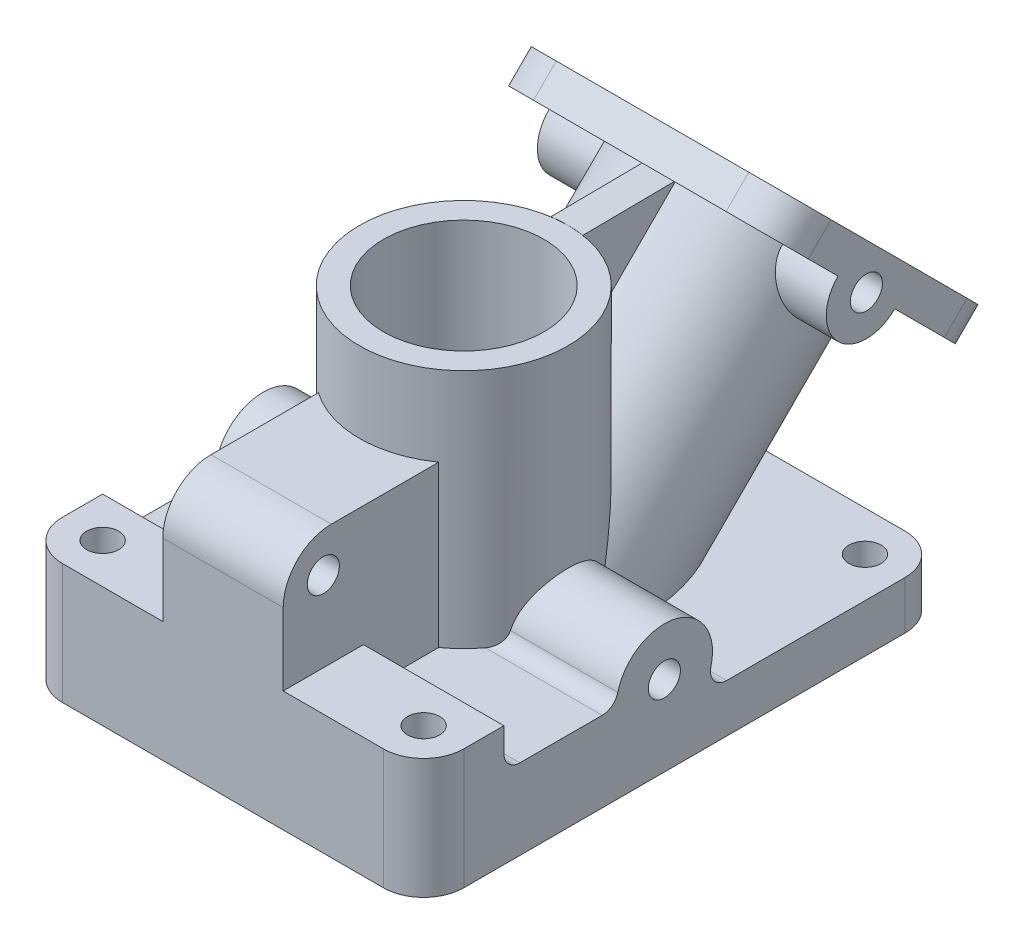
from build123d import *

# Parameters (mm, degrees)
CROQUIS1_W                   = 50
CROQUIS1_H                   = 65
SALIENTE_EXTRUIR1_DEPTH      = 6
CROQUIS3_R                   = 13
CROQUIS3_R_2                 = 10
SALIENTE_EXTRUIR2_DEPTH      = 34
SALIENTE_EXTRUIR3_REACH      = 79.942
CROQUIS9_R                   = 13
CROQUIS9_R_2                 = 10
CROQUIS3_3_R                 = 10
CORTAR_EXTRUIR1_DEPTH        = 34
CROQUIS10_W                  = 36
CROQUIS10_H                  = 36
CROQUIS10_R                  = 10
SALIENTE_EXTRUIR4_DEPTH      = 4
CORTAR_EXTRUIR7_START        = -4
CROQUIS12_R                  = 2
CORTAR_EXTRUIR7_DEPTH        = 4
MATRIZL1_COUNT               = 2
MATRIZL1_PITCH               = 26
MATRIZL1_COUNT_DIR2          = 2
MATRIZL1_PITCH_DIR2          = 26
SALIENTE_EXTRUIR6_REACH      = 80.545
SALIENTE_EXTRUIR6_END_RADIUS = 13
CORTAR_EXTRUIR8_REACH        = 80.545
SALIENTE_EXTRUIR7_REACH      = 80.545
SALIENTE_EXTRUIR7_END_RADIUS = 13
CORTAR_EXTRUIR9_REACH        = 80.545
SALIENTE_EXTRUIR8_REACH      = 84.586
SALIENTE_EXTRUIR8_END_RADIUS = 13
CROQUIS16_R                  = 2
SALIENTE_EXTRUIR9_START      = 24
CROQUIS17_W                  = 7.5
CROQUIS17_H                  = 17
SALIENTE_EXTRUIR9_DEPTH      = 24
CROQUIS18_R                  = 2
CORTAR_EXTRUIR10_DEPTH       = 15
SALIENTE_EXTRUIR10_DEPTH     = 17.5
SALIENTE_EXTRUIR11_REACH     = 84.586
CROQUIS19_R                  = 2
SALIENTE_EXTRUIR12_START     = 17.5
SALIENTE_EXTRUIR12_DEPTH     = 17.5
REDONDEO1_R                  = 5
REDONDEO2_R                  = 6
CROQUIS21_R                  = 2
CORTAR_EXTRUIR11_DEPTH       = 15
MATRIZL2_COUNT               = 2
MATRIZL2_PITCH               = 40
MATRIZL2_COUNT_DIR2          = 2
MATRIZL2_PITCH_DIR2          = 55
NERVIO2_REACH                = 72.323
CROQUIS22_WALL_W             = 153.876760578
CROQUIS22_WALL_H             = 4
NERVIO13_REACH               = 72.323
CROQUIS23_WALL_W             = 150.81965946
CROQUIS23_WALL_H             = 4


with BuildPart() as part:
    # Croquis1 → Saliente-Extruir1 (new body)
    with BuildSketch(Plane(origin=(0, 0, 0), x_dir=(1, 0, 0), z_dir=(0, 1, 0))):
        Rectangle(CROQUIS1_W, CROQUIS1_H)
    extrude(amount=SALIENTE_EXTRUIR1_DEPTH)

    # Croquis3 → Saliente-Extruir2 (add)
    with BuildSketch(Plane(origin=(0, 40, 0), x_dir=(1, 0, 0), z_dir=(0, 1, 0))):
        with Locations(Location((0, -2.5, 0), (0, 0, 270))):
            Circle(CROQUIS3_R)
        with Locations(Location((0, -2.5, 0), (0, 0, 270))):
            Circle(CROQUIS3_R_2, mode=Mode.SUBTRACT)
    extrude(amount=-SALIENTE_EXTRUIR2_DEPTH)

    # Saliente-Extruir3: up to this plane
    saliente_extruir3_end = Plane(origin=(0, 6, 0), z_dir=(0, 1, 0))
    # Croquis9 → Saliente-Extruir3 (add, up to the surface)
    with BuildSketch(Plane(origin=(0, 35, -32.5), x_dir=(-1, 0, 0), z_dir=(0, 0.7071067811865465, -0.7071067811865486)), mode=Mode.PRIVATE) as saliente_extruir3_sk1:
        with Locations(Location((0, -1.767766953, 0), (0, 0, 90))):
            Circle(CROQUIS9_R)
        with Locations(Location((0, -1.767766953, 0), (0, 0, 90))):
            Circle(CROQUIS9_R_2, mode=Mode.SUBTRACT)
    saliente_extruir3_tool1 = split(extrude(saliente_extruir3_sk1.sketch, amount=-SALIENTE_EXTRUIR3_REACH, mode=Mode.PRIVATE), bisect_by=saliente_extruir3_end, keep=Keep.BOTH, mode=Mode.PRIVATE)
    add(saliente_extruir3_tool1.solids().sort_by_distance((0, 24.817612, -42.682388))[0])

    # Croquis3<3> → Cortar-Extruir1 (cut)
    with BuildSketch(Plane(origin=(0, 40, 0), x_dir=(1, 0, 0), z_dir=(0, 1, 0))):
        with Locations(Location((0, -2.5, 0), (0, 0, 270))):
            Circle(CROQUIS3_3_R)
    extrude(amount=-CORTAR_EXTRUIR1_DEPTH, mode=Mode.SUBTRACT)

    # Croquis10 → Saliente-Extruir4 (add)
    with BuildSketch(Plane(origin=(0, 35, -32.5), x_dir=(-1, 0, 0), z_dir=(0, 0.7071067811865465, -0.7071067811865486))):
        with Locations((0, -1.767766953)):
            Rectangle(CROQUIS10_W, CROQUIS10_H)
        with Locations(Location((0, -1.767766953, 0), (0, 0, 90))):
            Circle(CROQUIS10_R, mode=Mode.SUBTRACT)
    extrude(amount=-SALIENTE_EXTRUIR4_DEPTH)

    # Croquis12 → Cortar-Extruir7 (cut)
    with BuildSketch(Plane(origin=(0, 35, -32.5), x_dir=(-1, 0, 0), z_dir=(0, 0.7071067811865465, -0.7071067811865486)).offset(CORTAR_EXTRUIR7_START)):
        with Locations(Location((13, -14.767766953, 0), (0, 0, 90))):
            Circle(CROQUIS12_R)
    cortar_extruir7 = extrude(amount=CORTAR_EXTRUIR7_DEPTH, mode=Mode.SUBTRACT)

    # MatrizL1: Cortar-Extruir7 2 × 2
    with Locations(*[Vector(0, 0.7071067811865486, 0.7071067811865465) * (i * MATRIZL1_PITCH) + Vector(1, 0, 0) * (j * MATRIZL1_PITCH_DIR2) for i in range(MATRIZL1_COUNT) for j in range(MATRIZL1_COUNT_DIR2) if (i, j) != (0, 0)]):
        add(cortar_extruir7, mode=Mode.SUBTRACT)

    # Saliente-Extruir6: up to this cylinder (the profile starts outside it)
    saliente_extruir6_end = Plane(origin=(0, 29.249557, -29.249557), z_dir=(0, 0.7071067811865465, -0.7071067811865486)) * Cylinder(SALIENTE_EXTRUIR6_END_RADIUS, 188.09, mode=Mode.PRIVATE)
    # Croquis13 → Saliente-Extruir6 (add, up to the surface)
    with BuildSketch(Plane(origin=(18, 0, 0), x_dir=(0, 0, -1), z_dir=(1, 0, 0)), mode=Mode.PRIVATE) as saliente_extruir6_sk1:
        with BuildLine():
            Line((28.257359313, 33.585786438), (26.136038969, 35.707106781))
            ThreePointArc((26.136038969, 35.707106781), (26.136038969, 28.636038969), (33.207106781, 28.636038969))
            Line((33.207106781, 28.636038969), (31.085786438, 30.757359313))
            ThreePointArc((31.085786438, 30.757359313), (28.257359313, 30.757359313), (28.257359313, 33.585786438))
        make_face()
    saliente_extruir6_tool1 = extrude(saliente_extruir6_sk1.sketch, amount=-SALIENTE_EXTRUIR6_REACH, mode=Mode.PRIVATE) - saliente_extruir6_end
    add(saliente_extruir6_tool1.solids().sort_by_distance((18, 30.499557, -27.999557))[0])

    # Croquis13<3> → Cortar-Extruir8 (cut, up to next)
    with BuildSketch(Plane(origin=(18, 0, 0), x_dir=(0, 0, -1), z_dir=(1, 0, 0)), mode=Mode.PRIVATE) as cortar_extruir8_sk1:
        with BuildLine():
            ThreePointArc((31.671572875, 32.171572875), (30.43693974, 34.01933194), (28.257359313, 33.585786438))
            Line((28.257359313, 33.585786438), (31.085786438, 30.757359313))
            ThreePointArc((31.085786438, 30.757359313), (31.51933194, 31.406206011), (31.671572875, 32.171572875))
        make_face()
    cortar_extruir8_tool1 = extrude(cortar_extruir8_sk1.sketch, amount=-CORTAR_EXTRUIR8_REACH, mode=Mode.PRIVATE) & part.part
    # Croquis13<3> → Cortar-Extruir8 (cut, up to next)
    with BuildSketch(Plane(origin=(18, 0, 0), x_dir=(0, 0, -1), z_dir=(1, 0, 0)), mode=Mode.PRIVATE) as cortar_extruir8_sk2:
        with BuildLine():
            Line((31.085786438, 30.757359313), (28.257359313, 33.585786438))
            ThreePointArc((28.257359313, 33.585786438), (28.257359313, 30.757359313), (31.085786438, 30.757359313))
        make_face()
    cortar_extruir8_tool2 = extrude(cortar_extruir8_sk2.sketch, amount=-CORTAR_EXTRUIR8_REACH, mode=Mode.PRIVATE) & part.part
    # Croquis13<3> → Cortar-Extruir8 (cut, up to next)
    with BuildSketch(Plane(origin=(18, 0, 0), x_dir=(0, 0, -1), z_dir=(1, 0, 0)), mode=Mode.PRIVATE) as cortar_extruir8_sk3:
        with BuildLine():
            ThreePointArc((31.671572875, 32.171572875), (30.43693974, 34.01933194), (28.257359313, 33.585786438))
            Line((28.257359313, 33.585786438), (31.085786438, 30.757359313))
            ThreePointArc((31.085786438, 30.757359313), (31.51933194, 31.406206011), (31.671572875, 32.171572875))
        make_face()
    cortar_extruir8_tool3 = extrude(cortar_extruir8_sk3.sketch, amount=-CORTAR_EXTRUIR8_REACH, mode=Mode.PRIVATE) & part.part
    # Croquis13<3> → Cortar-Extruir8 (cut, up to next)
    with BuildSketch(Plane(origin=(18, 0, 0), x_dir=(0, 0, -1), z_dir=(1, 0, 0)), mode=Mode.PRIVATE) as cortar_extruir8_sk4:
        with BuildLine():
            Line((31.085786438, 30.757359313), (28.257359313, 33.585786438))
            ThreePointArc((28.257359313, 33.585786438), (28.257359313, 30.757359313), (31.085786438, 30.757359313))
        make_face()
    cortar_extruir8_tool4 = extrude(cortar_extruir8_sk4.sketch, amount=-CORTAR_EXTRUIR8_REACH, mode=Mode.PRIVATE) & part.part
    add(cortar_extruir8_tool1.solids().sort_by_distance((18, 32.771784, -30.271784))[0], mode=Mode.SUBTRACT)
    add(cortar_extruir8_tool2.solids().sort_by_distance((18, 31.571362, -29.071362))[0], mode=Mode.SUBTRACT)
    add(cortar_extruir8_tool3.solids().sort_by_distance((18, 32.771784, -30.271784))[0], mode=Mode.SUBTRACT)
    add(cortar_extruir8_tool4.solids().sort_by_distance((18, 31.571362, -29.071362))[0], mode=Mode.SUBTRACT)

    # Saliente-Extruir7: up to this cylinder (the profile starts outside it)
    saliente_extruir7_end = Plane(origin=(0, 29.249557, -29.249557), z_dir=(0, 0.7071067811865465, -0.7071067811865486)) * Cylinder(SALIENTE_EXTRUIR7_END_RADIUS, 188.09, mode=Mode.PRIVATE)
    # Croquis14 → Saliente-Extruir7 (add, up to the surface)
    with BuildSketch(Plane.ZY.offset(18), mode=Mode.PRIVATE) as saliente_extruir7_sk1:
        with BuildLine():
            Line((-31.085786438, 30.757359313), (-33.207106781, 28.636038969))
            ThreePointArc((-33.207106781, 28.636038969), (-26.136038969, 28.636038969), (-26.136038969, 35.707106781))
            Line((-26.136038969, 35.707106781), (-28.257359313, 33.585786438))
            ThreePointArc((-28.257359313, 33.585786438), (-27.82381381, 32.93693974), (-27.671572875, 32.171572875))
            ThreePointArc((-27.671572875, 32.171572875), (-28.906206011, 30.32381381), (-31.085786438, 30.757359313))
        make_face()
    saliente_extruir7_tool1 = extrude(saliente_extruir7_sk1.sketch, amount=-SALIENTE_EXTRUIR7_REACH, mode=Mode.PRIVATE) - saliente_extruir7_end
    add(saliente_extruir7_tool1.solids().sort_by_distance((-18, 30.499557, -27.999557))[0])

    # Croquis14<3> → Cortar-Extruir9 (cut, up to next)
    with BuildSketch(Plane.ZY.offset(18), mode=Mode.PRIVATE) as cortar_extruir9_sk1:
        with BuildLine():
            ThreePointArc((-28.257359313, 33.585786438), (-31.085786438, 33.585786438), (-31.085786438, 30.757359313))
            Line((-31.085786438, 30.757359313), (-28.257359313, 33.585786438))
        make_face()
    cortar_extruir9_tool1 = extrude(cortar_extruir9_sk1.sketch, amount=-CORTAR_EXTRUIR9_REACH, mode=Mode.PRIVATE) & part.part
    # Croquis14<3> → Cortar-Extruir9 (cut, up to next)
    with BuildSketch(Plane.ZY.offset(18), mode=Mode.PRIVATE) as cortar_extruir9_sk2:
        with BuildLine():
            Line((-28.257359313, 33.585786438), (-31.085786438, 30.757359313))
            ThreePointArc((-31.085786438, 30.757359313), (-28.906206011, 30.32381381), (-27.671572875, 32.171572875))
            ThreePointArc((-27.671572875, 32.171572875), (-27.82381381, 32.93693974), (-28.257359313, 33.585786438))
        make_face()
    cortar_extruir9_tool2 = extrude(cortar_extruir9_sk2.sketch, amount=-CORTAR_EXTRUIR9_REACH, mode=Mode.PRIVATE) & part.part
    # Croquis14<3> → Cortar-Extruir9 (cut, up to next)
    with BuildSketch(Plane.ZY.offset(18), mode=Mode.PRIVATE) as cortar_extruir9_sk3:
        with BuildLine():
            ThreePointArc((-28.257359313, 33.585786438), (-31.085786438, 33.585786438), (-31.085786438, 30.757359313))
            Line((-31.085786438, 30.757359313), (-28.257359313, 33.585786438))
        make_face()
    cortar_extruir9_tool3 = extrude(cortar_extruir9_sk3.sketch, amount=-CORTAR_EXTRUIR9_REACH, mode=Mode.PRIVATE) & part.part
    # Croquis14<3> → Cortar-Extruir9 (cut, up to next)
    with BuildSketch(Plane.ZY.offset(18), mode=Mode.PRIVATE) as cortar_extruir9_sk4:
        with BuildLine():
            Line((-28.257359313, 33.585786438), (-31.085786438, 30.757359313))
            ThreePointArc((-31.085786438, 30.757359313), (-28.906206011, 30.32381381), (-27.671572875, 32.171572875))
            ThreePointArc((-27.671572875, 32.171572875), (-27.82381381, 32.93693974), (-28.257359313, 33.585786438))
        make_face()
    cortar_extruir9_tool4 = extrude(cortar_extruir9_sk4.sketch, amount=-CORTAR_EXTRUIR9_REACH, mode=Mode.PRIVATE) & part.part
    add(cortar_extruir9_tool1.solids().sort_by_distance((-18, 32.771784, -30.271784))[0], mode=Mode.SUBTRACT)
    add(cortar_extruir9_tool2.solids().sort_by_distance((-18, 31.571362, -29.071362))[0], mode=Mode.SUBTRACT)
    add(cortar_extruir9_tool3.solids().sort_by_distance((-18, 32.771784, -30.271784))[0], mode=Mode.SUBTRACT)
    add(cortar_extruir9_tool4.solids().sort_by_distance((-18, 31.571362, -29.071362))[0], mode=Mode.SUBTRACT)

    # Saliente-Extruir8: up to this cylinder (the profile starts outside it)
    saliente_extruir8_end = Plane(origin=(0, 9.925201, 2.5), z_dir=(0, 1, 0)) * Cylinder(SALIENTE_EXTRUIR8_END_RADIUS, 196.172, mode=Mode.PRIVATE)
    # Croquis16 → Saliente-Extruir8 (add, up to the surface)
    with BuildSketch(Plane(origin=(25, 0, 0), x_dir=(0, 0, -1), z_dir=(1, 0, 0)), mode=Mode.PRIVATE) as saliente_extruir8_sk1:
        with BuildLine():
            Line((-15.5, 10), (-15.5, 6))
            Line((-15.5, 6), (5.245966692, 6))
            ThreePointArc((5.245966692, 6), (3.664827862, 6.775255129), (3.309475019, 8.5))
            ThreePointArc((3.309475019, 8.5), (-1, 15.809475019), (-8.309475019, 11.5))
            ThreePointArc((-8.309475019, 11.5), (-9.021221821, 10.41886117), (-10.245966692, 10))
            Line((-10.245966692, 10), (-15.5, 10))
        make_face()
        with Locations((-2.5, 10)):
            Circle(CROQUIS16_R, mode=Mode.SUBTRACT)
    saliente_extruir8_tool1 = extrude(saliente_extruir8_sk1.sketch, amount=-SALIENTE_EXTRUIR8_REACH, mode=Mode.PRIVATE) - saliente_extruir8_end
    add(saliente_extruir8_tool1.solids().sort_by_distance((25, 9.925201, 4.724802))[0])

    # Croquis17 → Saliente-Extruir9 (add)
    with BuildSketch(Plane(origin=(0, 6, 0), x_dir=(1, 0, 0), z_dir=(0, 1, 0)).offset(SALIENTE_EXTRUIR9_START)):
        with Locations((3.75, -24)):
            Rectangle(CROQUIS17_W, CROQUIS17_H)
        with BuildLine():
            Line((-7.5, -13.118380291), (-7.5, -32.5))
            Line((-7.5, -32.5), (0, -32.5))
            Line((0, -32.5), (0, -15.5))
            ThreePointArc((0, -15.5), (-3.934530227, -14.89029749), (-7.5, -13.118380291))
        make_face()
        with BuildLine():
            ThreePointArc((7.5, -13.118380291), (3.934530227, -14.89029749), (0, -15.5))
            Line((0, -15.5), (7.5, -15.5))
            Line((7.5, -15.5), (7.5, -13.118380291))
        make_face()
    extrude(amount=-SALIENTE_EXTRUIR9_DEPTH)

    # Croquis18 → Cortar-Extruir10 (cut)
    with BuildSketch(Plane(origin=(7.5, 0, 0), x_dir=(0, 0, -1), z_dir=(1, 0, 0))):
        with Locations((-27.5, 25)):
            Circle(CROQUIS18_R)
        with BuildLine():
            Line((-26.5, 30), (-32.5, 30))
            Line((-32.5, 30), (-32.5, 24))
            ThreePointArc((-32.5, 24), (-30.742640687, 28.242640687), (-26.5, 30))
        make_face()
    extrude(amount=-CORTAR_EXTRUIR10_DEPTH, mode=Mode.SUBTRACT)

    # Croquis16<5> → Saliente-Extruir10 (add)
    with BuildSketch(Plane(origin=(25, 0, 0), x_dir=(0, 0, -1), z_dir=(1, 0, 0))):
        Polygon((-22.5, 6), (-22.5, 12), (-22.5, 15), (-32.5, 15), (-32.5, 6), align=None)
        with BuildLine():
            ThreePointArc((-20.5, 10), (-21.914213562, 10.585786438), (-22.5, 12))
            Line((-22.5, 12), (-22.5, 6))
            Line((-22.5, 6), (-15.5, 6))
            Line((-15.5, 6), (-15.5, 10))
            Line((-15.5, 10), (-20.5, 10))
        make_face()
    extrude(amount=-SALIENTE_EXTRUIR10_DEPTH)

    # Croquis19 → Saliente-Extruir11 (add, up to next)
    with BuildSketch(Plane(origin=(-25, 0, 0), x_dir=(0, 0, -1), z_dir=(1, 0, 0)), mode=Mode.PRIVATE) as saliente_extruir11_sk1:
        with BuildLine():
            Line((-10.245966692, 10), (-15.372983346, 10))
            Line((-15.372983346, 10), (-15.372983346, 6))
            Line((-15.372983346, 6), (5.245966692, 6))
            ThreePointArc((5.245966692, 6), (3.664827862, 6.775255129), (3.309475019, 8.5))
            ThreePointArc((3.309475019, 8.5), (-1, 15.809475019), (-8.309475019, 11.5))
            ThreePointArc((-8.309475019, 11.5), (-9.021221821, 10.41886117), (-10.245966692, 10))
        make_face()
        with Locations((-2.5, 10)):
            Circle(CROQUIS19_R, mode=Mode.SUBTRACT)
    saliente_extruir11_tool1 = extrude(saliente_extruir11_sk1.sketch, amount=SALIENTE_EXTRUIR11_REACH, mode=Mode.PRIVATE) - part.part
    add(saliente_extruir11_tool1.solids().sort_by_distance((-25, 9.93334, 4.679515))[0])

    # Croquis19<3> → Saliente-Extruir12 (add)
    with BuildSketch(Plane(origin=(-25, 0, 0), x_dir=(0, 0, -1), z_dir=(1, 0, 0)).offset(SALIENTE_EXTRUIR12_START)):
        with BuildLine():
            Line((-15.372983346, 6), (-15.372983346, 10))
            Line((-15.372983346, 10), (-20.5, 10))
            ThreePointArc((-20.5, 10), (-21.914213562, 10.585786438), (-22.5, 12))
            Line((-22.5, 12), (-22.5, 15))
            Line((-22.5, 15), (-32.5, 15))
            Line((-32.5, 15), (-32.5, 6))
            Line((-32.5, 6), (-15.372983346, 6))
        make_face()
    extrude(amount=-SALIENTE_EXTRUIR12_DEPTH)

    # Redondeo1
    redondeo1_edges = [part.edges().sort_by_distance(p)[0] for p in [
        (25, 7.5, 32.5),
        (-25, 7.5, 32.5),
        (-25, 3, -32.5),
        (25, 3, -32.5),
    ]]
    fillet(redondeo1_edges, radius=REDONDEO1_R)

    # Redondeo2
    redondeo2_edges = [part.edges().sort_by_distance(p)[0] for p in [
        (-18, 45.063708499, -19.607864376),
        (-18, 19.607864376, -45.063708499),
        (18, 19.607864376, -45.063708499),
        (18, 45.063708499, -19.607864376),
    ]]
    fillet(redondeo2_edges, radius=REDONDEO2_R)

    # Croquis21 → Cortar-Extruir11 (cut)
    with BuildSketch(Plane(origin=(0, 15, 0), x_dir=(1, 0, 0), z_dir=(0, 1, 0))):
        with Locations(Location((-20, -27.5, 0), (0, 0, 270))):
            Circle(CROQUIS21_R)
    cortar_extruir11 = extrude(amount=-CORTAR_EXTRUIR11_DEPTH, mode=Mode.SUBTRACT)

    # MatrizL2: Cortar-Extruir11 2 × 2
    with Locations(*[(i * MATRIZL2_PITCH, 0, -j * MATRIZL2_PITCH_DIR2) for i in range(MATRIZL2_COUNT) for j in range(MATRIZL2_COUNT_DIR2) if (i, j) != (0, 0)]):
        add(cortar_extruir11, mode=Mode.SUBTRACT)

    # Croquis22 wall → Nervio2 (add, up to next)
    with BuildSketch(Plane(origin=(0, 40.056980516, -16.11459236), x_dir=(0, 0.010148124337, -0.99994850646), z_dir=(0, 0.99994850646, 0.010148124337)), mode=Mode.PRIVATE) as nervio2_sk1:
        Rectangle(CROQUIS22_WALL_W, CROQUIS22_WALL_H)
    nervio2_tool1 = extrude(nervio2_sk1.sketch, amount=-NERVIO2_REACH, mode=Mode.PRIVATE) - part.part
    add(nervio2_tool1.solids().sort_by_distance((0, 40.056980516, -16.11459236))[0])

    # Croquis23 wall → Nervio13 (add, up to next)
    with BuildSketch(Plane(origin=(0, 10.086230713, -32.528618869), x_dir=(0, 0.999975474765, -0.007003561136), z_dir=(0, 0.007003561136, 0.999975474765)), mode=Mode.PRIVATE) as nervio13_sk1:
        Rectangle(CROQUIS23_WALL_W, CROQUIS23_WALL_H)
    nervio13_tool1 = extrude(nervio13_sk1.sketch, amount=NERVIO13_REACH, mode=Mode.PRIVATE) - part.part
    add(nervio13_tool1.solids().sort_by_distance((0, 10.086230713, -32.528618869))[0])


solid = part.part
